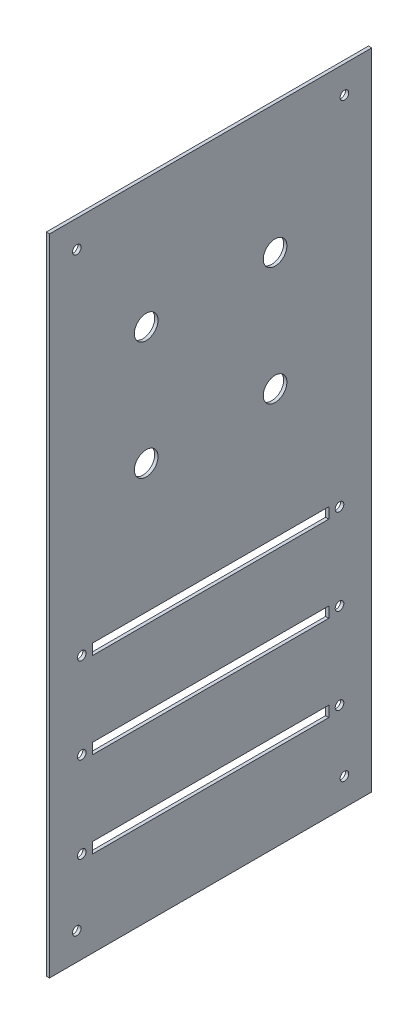
from build123d import *

# Parameters (mm, degrees)
SKETCH1_W                            = 300
SKETCH1_H                            = 150
BOSS_EXTRUDE1_DEPTH                  = 1.52
F_4_0_4_DIAMETER_HOLE1_D             = 4
MIRROR2_AT_THE_SECOND_PLANE_COPY_1_D = 4
SKETCH14_W                           = 5
SKETCH14_H                           = 110
CUT_EXTRUDE2_DEPTH                   = 168.711986453
F_4_0_4_DIAMETER_HOLE2_D             = 4
SKETCH22_W                           = 5
SKETCH22_H                           = 110
CUT_EXTRUDE3_DEPTH                   = 168.711986453
SKETCH23_W                           = 5
SKETCH23_H                           = 110
CUT_EXTRUDE4_DEPTH                   = 168.711986453
F_4_0_4_DIAMETER_HOLE3_D             = 4
F_4_0_4_DIAMETER_HOLE4_D             = 4
F_11_0_11_DIAMETER_HOLE1_D           = 11


with BuildPart() as part:
    # Sketch1 → Boss-Extrude1 (new body)
    with BuildSketch(Plane.YZ):
        Rectangle(SKETCH1_W, SKETCH1_H)
    extrude(amount=BOSS_EXTRUDE1_DEPTH)

    # Ø4.0 (4) Diameter Hole1 (through all)
    with Locations(Plane.YZ.offset(1.52)):
        with Locations((-137.3, 62.3)):
            f_4_0_4_diameter_hole1 = Hole(F_4_0_4_DIAMETER_HOLE1_D / 2)

    # Mirror2: Ø4.0 (4) Diameter Hole1 across plane
    add(f_4_0_4_diameter_hole1.mirror(Plane.ZX), mode=Mode.SUBTRACT)

    # Mirror2 at the second plane: Ø4.0 (4) Diameter Hole1 across plane
    add(f_4_0_4_diameter_hole1.mirror(Plane.XY), mode=Mode.SUBTRACT)

    # Mirror2 at the second plane copy 1 (through all)
    with Locations(Plane(origin=(1.52, 0, 0), x_dir=(0, -1, 0), z_dir=(1, 0, 0))):
        with Locations((-137.3, 62.3)):
            Hole(MIRROR2_AT_THE_SECOND_PLANE_COPY_1_D / 2)

    # Sketch14 → Cut-Extrude2 (cut, through all)
    with BuildSketch(Plane.YZ.offset(1.52)):
        with Locations((-107.5, 0)):
            Rectangle(SKETCH14_W, SKETCH14_H)
    extrude(amount=-CUT_EXTRUDE2_DEPTH, mode=Mode.SUBTRACT)

    # Ø4.0 (4) Diameter Hole2 (through all)
    with Locations(Plane.YZ.offset(1.52)):
        with Locations((-107.5, 60)):
            f_4_0_4_diameter_hole2 = Hole(F_4_0_4_DIAMETER_HOLE2_D / 2)

    # Mirror4: Ø4.0 (4) Diameter Hole2 across plane
    add(f_4_0_4_diameter_hole2.mirror(Plane.XY), mode=Mode.SUBTRACT)

    # Sketch22 → Cut-Extrude3 (cut, through all)
    with BuildSketch(Plane.YZ.offset(1.52)):
        with Locations((-67.5, 0)):
            Rectangle(SKETCH22_W, SKETCH22_H)
    extrude(amount=-CUT_EXTRUDE3_DEPTH, mode=Mode.SUBTRACT)

    # Sketch23 → Cut-Extrude4 (cut, through all)
    with BuildSketch(Plane.YZ.offset(1.52)):
        with Locations((-27.5, 0)):
            Rectangle(SKETCH23_W, SKETCH23_H)
    extrude(amount=-CUT_EXTRUDE4_DEPTH, mode=Mode.SUBTRACT)

    # Ø4.0 (4) Diameter Hole3 (through all)
    with Locations(Plane.YZ.offset(1.52)):
        with Locations((-67.5, 60)):
            f_4_0_4_diameter_hole3 = Hole(F_4_0_4_DIAMETER_HOLE3_D / 2)

    # Mirror5: Ø4.0 (4) Diameter Hole3 across plane
    add(f_4_0_4_diameter_hole3.mirror(Plane.XY), mode=Mode.SUBTRACT)

    # Ø4.0 (4) Diameter Hole4 (through all)
    with Locations(Plane.YZ.offset(1.52)):
        with Locations((-27.5, 60)):
            f_4_0_4_diameter_hole4 = Hole(F_4_0_4_DIAMETER_HOLE4_D / 2)

    # Mirror6: Ø4.0 (4) Diameter Hole4 across plane
    add(f_4_0_4_diameter_hole4.mirror(Plane.XY), mode=Mode.SUBTRACT)

    # Ø11.0 (11) Diameter Hole1 (through all)
    with Locations(Plane.YZ.offset(1.52)):
        with Locations((35, 30), (90, 30)):
            f_11_0_11_diameter_hole1 = Hole(F_11_0_11_DIAMETER_HOLE1_D / 2)

    # Mirror7: Ø11.0 (11) Diameter Hole1 across plane
    add(f_11_0_11_diameter_hole1.mirror(Plane.XY), mode=Mode.SUBTRACT)


solid = part.part
